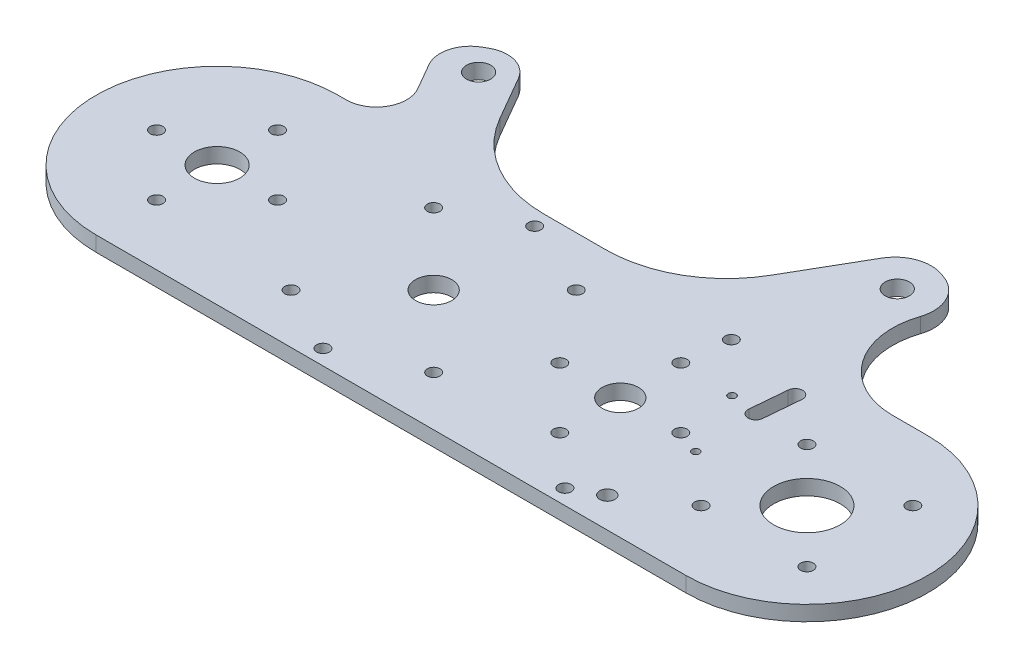
from build123d import *

# Parameters (mm, degrees)
SKETCH1_R           = 11
SKETCH1_R_2         = 6
SKETCH1_R_3         = 7.5
SKETCH1_R_4         = 2.1
SKETCH1_R_5         = 2.5
SKETCH1_R_6         = 1.25
BOSS_EXTRUDE1_DEPTH = 5
SKETCH4_R           = 4
BOSS_EXTRUDE2_DEPTH = 5
FILLET1_R           = 40
FILLET2_R           = 10
CUT_EXTRUDE2_DEPTH  = 159.977801764
SKETCH7_R           = 4
BOSS_EXTRUDE3_DEPTH = 5
FILLET3_R           = 25
FILLET4_R           = 12
FILLET5_R           = 40


with BuildPart() as part:
    # Sketch1 → Boss-Extrude1 (new body)
    with BuildSketch(Plane(origin=(0, 0, 0), x_dir=(1, 0, 0), z_dir=(0, 1, 0))):
        with BuildLine():
            Line((-97.5, 40), (97.5, 40))
            ThreePointArc((97.5, 40), (137.5, 0), (97.5, -40))
            Line((97.5, -40), (-97.5, -40))
            ThreePointArc((-97.5, -40), (-137.5, 0), (-97.5, 40))
        make_face()
        with Locations(Location((97.5, 0, 0), (0, 0, 270))):
            Circle(SKETCH1_R, mode=Mode.SUBTRACT)
        with Locations(Location((35.8, 0, 0), (0, 0, 270))):
            Circle(SKETCH1_R_2, mode=Mode.SUBTRACT)
        with Locations(Location((-97.5, 0, 0), (0, 0, 270))):
            Circle(SKETCH1_R_3, mode=Mode.SUBTRACT)
        with Locations(Location((-97.5, -20, 0), (0, 0, 270))):
            Circle(SKETCH1_R_4, mode=Mode.SUBTRACT)
        with Locations(Location((-117.5, 0, 0), (0, 0, 270))):
            Circle(SKETCH1_R_4, mode=Mode.SUBTRACT)
        with Locations(Location((-97.5, 20, 0), (0, 0, 270))):
            Circle(SKETCH1_R_4, mode=Mode.SUBTRACT)
        with Locations(Location((-77.5, 0, 0), (0, 0, 270))):
            Circle(SKETCH1_R_4, mode=Mode.SUBTRACT)
        with Locations(Location((-25.9, 0, 0), (0, 0, 270))):
            Circle(SKETCH1_R_2, mode=Mode.SUBTRACT)
        with Locations(Location((-27.5, 35, 0), (0, 0, 270))):
            Circle(SKETCH1_R_4, mode=Mode.SUBTRACT)
        with Locations(Location((37.5, 35, 0), (0, 0, 270))):
            Circle(SKETCH1_R_4, mode=Mode.SUBTRACT)
        with Locations(Location((52.5, -35, 0), (0, 0, 270))):
            Circle(SKETCH1_R_4, mode=Mode.SUBTRACT)
        with Locations(Location((-27.5, -35, 0), (0, 0, 270))):
            Circle(SKETCH1_R_4, mode=Mode.SUBTRACT)
        with Locations(Location((115, 17.5, 0), (0, 0, 270))):
            Circle(SKETCH1_R_4, mode=Mode.SUBTRACT)
        with Locations(Location((115, -17.5, 0), (0, 0, 270))):
            Circle(SKETCH1_R_4, mode=Mode.SUBTRACT)
        with Locations(Location((80, -17.5, 0), (0, 0, 270))):
            Circle(SKETCH1_R_4, mode=Mode.SUBTRACT)
        with Locations(Location((80, 17.5, 0), (0, 0, 270))):
            Circle(SKETCH1_R_4, mode=Mode.SUBTRACT)
        with Locations(Location((55.8, 0, 0), (0, 0, 270))):
            Circle(SKETCH1_R_4, mode=Mode.SUBTRACT)
        with Locations(Location((35.8, -20, 0), (0, 0, 270))):
            Circle(SKETCH1_R_4, mode=Mode.SUBTRACT)
        with Locations(Location((15.8, 0, 0), (0, 0, 270))):
            Circle(SKETCH1_R_4, mode=Mode.SUBTRACT)
        with Locations(Location((35.8, 20, 0), (0, 0, 270))):
            Circle(SKETCH1_R_4, mode=Mode.SUBTRACT)
        with Locations(Location((-2.33, -23.57, 0), (0, 0, 270))):
            Circle(SKETCH1_R_4, mode=Mode.SUBTRACT)
        with Locations(Location((-49.47, -23.57, 0), (0, 0, 270))):
            Circle(SKETCH1_R_4, mode=Mode.SUBTRACT)
        with Locations(Location((-49.47, 23.57, 0), (0, 0, 270))):
            Circle(SKETCH1_R_4, mode=Mode.SUBTRACT)
        with Locations(Location((-2.33, 23.57, 0), (0, 0, 270))):
            Circle(SKETCH1_R_4, mode=Mode.SUBTRACT)
        with Locations(Location((61.5, -30, 0), (0, 0, 270))):
            Circle(SKETCH1_R_5, mode=Mode.SUBTRACT)
        with Locations(Location((53.643916542, 19.088290496, 0), (0, 0, 270))):
            Circle(SKETCH1_R_6, mode=Mode.SUBTRACT)
        with Locations(Location((63.643916542, -2.911709504, 0), (0, 0, 270))):
            Circle(SKETCH1_R_6, mode=Mode.SUBTRACT)
    extrude(amount=BOSS_EXTRUDE1_DEPTH)

    # Sketch4 → Boss-Extrude2 (add)
    with BuildSketch(Plane(origin=(0, 5, 0), x_dir=(1, 0, 0), z_dir=(0, 1, 0))):
        Polygon((-52.5, 40), (-77.5, 83.301270189), (-96.25, 72.475952642), (-77.5, 40), align=None)
        with Locations(Location((-80.857695155, 69.815698604, 0), (0, 0, 270))):
            Circle(SKETCH4_R, mode=Mode.SUBTRACT)
    extrude(amount=-BOSS_EXTRUDE2_DEPTH)

    # Fillet1
    fillet1_edges = [part.edges().sort_by_distance(p)[0] for p in [
        (-52.5, 2.5, -40),
    ]]
    fillet(fillet1_edges, radius=FILLET1_R)

    # Fillet2
    fillet2_edges = [part.edges().sort_by_distance(p)[0] for p in [
        (-77.5, 2.5, -40),
        (-96.25, 2.5, -72.475952642),
        (-77.5, 2.5, -83.301270189),
    ]]
    fillet(fillet2_edges, radius=FILLET2_R)

    # Sketch6 → Cut-Extrude2 (cut, through all)
    with BuildSketch(Plane(origin=(0, 5, 0), x_dir=(1, 0, 0), z_dir=(0, 1, 0))):
        with BuildLine():
            Line((65.244617832, 17.609884909), (66.290486745, 29.564221286))
            ThreePointArc((66.290486745, 29.564221286), (64.017889357, 32.272597388), (61.309513255, 30))
            Line((61.309513255, 30), (60.263644342, 18.045663623))
            ThreePointArc((60.263644342, 18.045663623), (62.53624173, 15.337287521), (65.244617832, 17.609884909))
        make_face()
    extrude(amount=-CUT_EXTRUDE2_DEPTH, mode=Mode.SUBTRACT)

    # Sketch7 → Boss-Extrude3 (add)
    with BuildSketch(Plane(origin=(0, 5, 0), x_dir=(1, 0, 0), z_dir=(0, 1, 0))):
        Polygon((14.047921201, 40), (42.5, 40), (67.5, 83.301270189), (44.047921201, 91.961524227), align=None)
        with Locations(Location((50.398774162, 76.961524227, 0), (0, 0, 270))):
            Circle(SKETCH7_R, mode=Mode.SUBTRACT)
    extrude(amount=-BOSS_EXTRUDE3_DEPTH)

    # Fillet3
    fillet3_edges = [part.edges().sort_by_distance(p)[0] for p in [
        (42.5, 2.5, -40),
    ]]
    fillet(fillet3_edges, radius=FILLET3_R)

    # Fillet4
    fillet4_edges = [part.edges().sort_by_distance(p)[0] for p in [
        (44.047921201, 2.5, -91.961524227),
        (67.5, 2.5, -83.301270189),
    ]]
    fillet(fillet4_edges, radius=FILLET4_R)

    # Fillet5
    fillet5_edges = [part.edges().sort_by_distance(p)[0] for p in [
        (14.047921201, 2.5, -40),
    ]]
    fillet(fillet5_edges, radius=FILLET5_R)


solid = part.part
